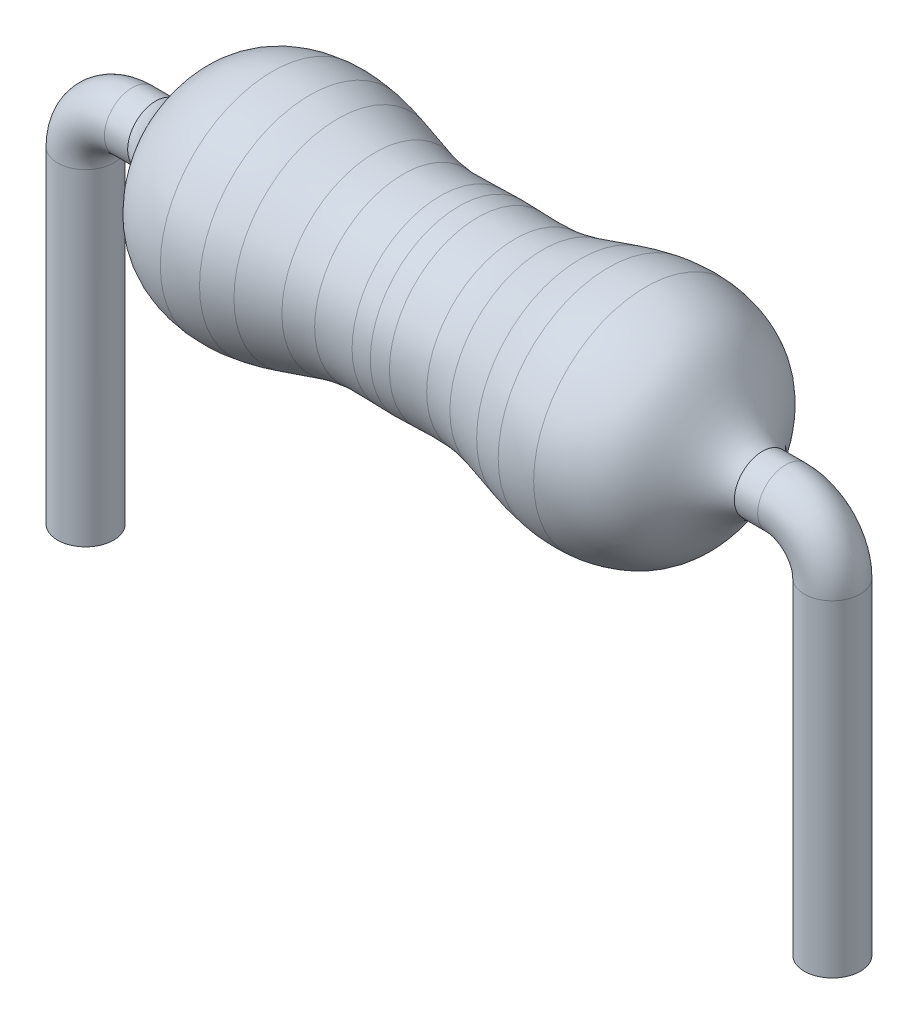
from build123d import *

# Parameters (mm, degrees)
SKETCH_5_R = 0.3


with BuildPart() as part:
    # Эскиз3 → Повернуть2 (revolve)
    with BuildSketch(Plane.XY):
        with BuildLine():
            Line((0, 0), (-3.25, 0))
            Line((-3.25, 0), (-3.25, 0.3))
            add(Edge.make_bspline(
                [(-2.000000082, 1.199999952), (-2.23604302, 1.181615986), (-2.789263679, 1.00505202), (-2.971144892, 0.430097598), (-3.25, 0.3)],
                knots=[0.780397484, 0.780397484, 0.780397484, 0.780397484, 0.876745066, 1, 1, 1, 1], degree=3))
            add(Edge.make_bspline(
                [(-1.6, 1.180025241), (-1.731399218, 1.201650855), (-1.864601443, 1.21054538), (-2.000000082, 1.199999952)],
                knots=[0.725130753, 0.725130753, 0.725130753, 0.725130753, 0.780397484, 0.780397484, 0.780397484, 0.780397484], degree=3))
            add(Edge.make_bspline(
                [(-1.3, 1.111050082), (-1.34982276, 1.125028982), (-1.449295193, 1.15139314), (-1.549743584, 1.171754066), (-1.6, 1.180025241)],
                knots=[0.682659096, 0.682659096, 0.682659096, 0.682659096, 0.70399282, 0.725130753, 0.725130753, 0.725130753, 0.725130753], degree=3))
            add(Edge.make_bspline(
                [(-0.9, 0.997661651), (-1.033638838, 1.030728014), (-1.166305516, 1.073539075), (-1.3, 1.111050082)],
                knots=[0.62541214, 0.62541214, 0.62541214, 0.62541214, 0.682659096, 0.682659096, 0.682659096, 0.682659096], degree=3))
            add(Edge.make_bspline(
                [(-0.6, 0.946228082), (-0.616698211, 0.947554212), (-0.71755748, 0.957111909), (-0.817198443, 0.977173996), (-0.9, 0.997661651)],
                knots=[0.582920397, 0.582920397, 0.582920397, 0.582920397, 0.589942383, 0.62541214, 0.62541214, 0.62541214, 0.62541214], degree=3))
            add(Edge.make_bspline(
                [(-0.2, 0.945686937), (-0.334396136, 0.941079864), (-0.468154451, 0.935757238), (-0.6, 0.946228082)],
                knots=[0.527476276, 0.527476276, 0.527476276, 0.527476276, 0.582920397, 0.582920397, 0.582920397, 0.582920397], degree=3))
            add(Edge.make_bspline(
                [(0, 0.95), (-0.066719861, 0.950074874), (-0.133438155, 0.947968664), (-0.2, 0.945686937)],
                knots=[0.500016684, 0.500016684, 0.500016684, 0.500016684, 0.527476276, 0.527476276, 0.527476276, 0.527476276], degree=3))
            add(Edge.make_bspline(
                [(0, 0.95), (0.066719861, 0.950074874), (0.133438155, 0.947968664), (0.2, 0.945686937)],
                knots=[0.500016684, 0.500016684, 0.500016684, 0.500016684, 0.527476276, 0.527476276, 0.527476276, 0.527476276], degree=3))
            add(Edge.make_bspline(
                [(0.2, 0.945686937), (0.334396136, 0.941079864), (0.468154451, 0.935757238), (0.6, 0.946228082)],
                knots=[0.527476276, 0.527476276, 0.527476276, 0.527476276, 0.582920397, 0.582920397, 0.582920397, 0.582920397], degree=3))
            add(Edge.make_bspline(
                [(0.6, 0.946228082), (0.616698211, 0.947554212), (0.71755748, 0.957111909), (0.817198443, 0.977173996), (0.9, 0.997661651)],
                knots=[0.582920397, 0.582920397, 0.582920397, 0.582920397, 0.589942383, 0.62541214, 0.62541214, 0.62541214, 0.62541214], degree=3))
            add(Edge.make_bspline(
                [(0.9, 0.997661651), (1.033638838, 1.030728014), (1.166305516, 1.073539075), (1.3, 1.111050082)],
                knots=[0.62541214, 0.62541214, 0.62541214, 0.62541214, 0.682659096, 0.682659096, 0.682659096, 0.682659096], degree=3))
            add(Edge.make_bspline(
                [(1.3, 1.111050082), (1.34982276, 1.125028982), (1.449295193, 1.15139314), (1.549743584, 1.171754066), (1.6, 1.180025241)],
                knots=[0.682659096, 0.682659096, 0.682659096, 0.682659096, 0.70399282, 0.725130753, 0.725130753, 0.725130753, 0.725130753], degree=3))
            add(Edge.make_bspline(
                [(1.6, 1.180025241), (1.731399218, 1.201650855), (1.864601443, 1.21054538), (2, 1.2)],
                knots=[0.725130753, 0.725130753, 0.725130753, 0.725130753, 0.780397484, 0.780397484, 0.780397484, 0.780397484], degree=3))
            add(Edge.make_bspline(
                [(2, 1.2), (2.23604302, 1.181615986), (2.789263679, 1.00505202), (2.971144892, 0.430097598), (3.25, 0.3)],
                knots=[0.780397484, 0.780397484, 0.780397484, 0.780397484, 0.876745066, 1, 1, 1, 1], degree=3))
            Line((3.25, 0.3), (3.25, 0))
            Line((3.25, 0), (0, 0))
        make_face()
    revolve(axis=Axis((0, 0, 0), (1, 0, 0)))

    # По траектории2: sweep along a path in Эскиз4
    with BuildLine(Plane.XY) as sweep_2_path:
        Line((2.987274619, 0), (3.5, 0))
        ThreePointArc((3.5, 0), (3.853553391, -0.146446609), (4, -0.5))
        Line((4, -0.5), (4, -4))
    # Эскиз5 → По траектории2 (sweep)
    with BuildSketch(Plane(origin=(0, -4, 0), x_dir=(1, 0, 0), z_dir=(0, 1, 0))):
        with Locations((4, 0)):
            Circle(SKETCH_5_R)
    sweep_2 = sweep(path=sweep_2_path.line)

    # Зеркальное отражение1: По траектории2 across plane
    add(sweep_2.mirror(Plane(origin=(0, 0, 0), x_dir=(0, 0, 1), z_dir=(1, 0, 0))))


solid = part.part
